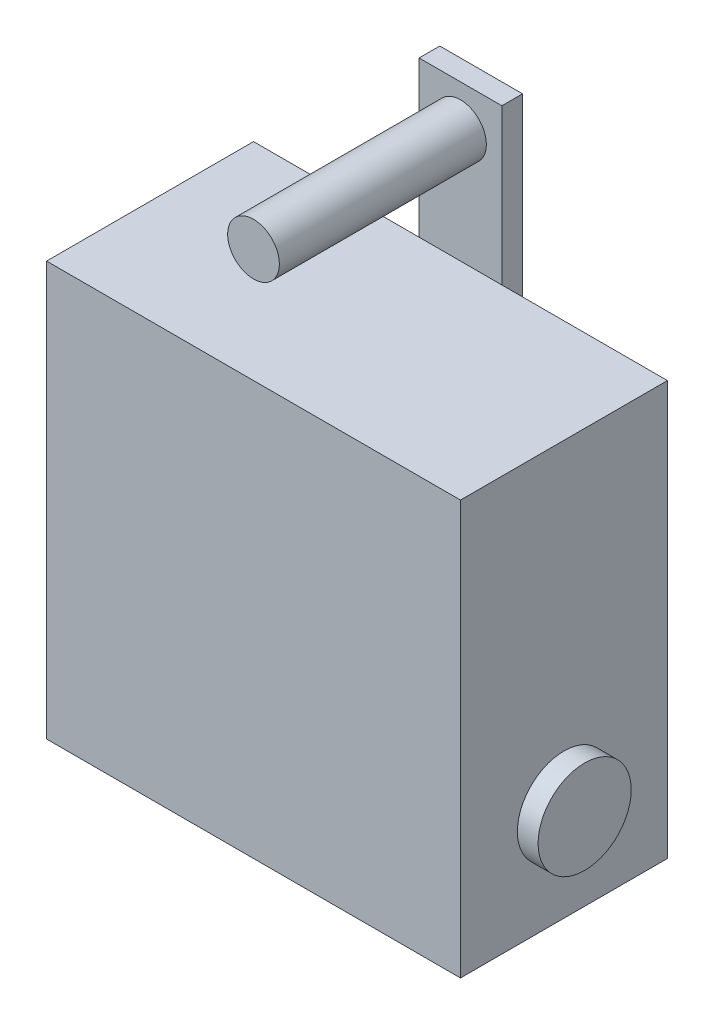
from build123d import *

# Parameters (mm, degrees)
ESQUISSE1_W        = 40
ESQUISSE1_H        = 20
BOSS_EXTRU_1_DEPTH = 40
ESQUISSE2_R        = 4.5
BOSS_EXTRU_2_DEPTH = 2
ESQUISSE3_W        = 8
ESQUISSE3_H        = 25
BOSS_EXTRU_3_DEPTH = 2
ESQUISSE4_R        = 2.5
BOSS_EXTRU_4_DEPTH = 20


with BuildPart() as part:
    # Esquisse1 → Boss.-Extru.1 (new body)
    with BuildSketch(Plane(origin=(0, 0, 0), x_dir=(1, 0, 0), z_dir=(0, 1, 0))):
        with Locations((20, 10)):
            Rectangle(ESQUISSE1_W, ESQUISSE1_H)
    extrude(amount=BOSS_EXTRU_1_DEPTH)

    # Esquisse2 → Boss.-Extru.2 (add)
    with BuildSketch(Plane(origin=(40, 0, 0), x_dir=(0, 0, -1), z_dir=(1, 0, 0))):
        with Locations(Location((10, 9.5, 0), (0, 0, 180))):
            Circle(ESQUISSE2_R)
    extrude(amount=BOSS_EXTRU_2_DEPTH)

    # Esquisse3 → Boss.-Extru.3 (add)
    with BuildSketch(Plane(origin=(0, 0, -20), x_dir=(-1, 0, 0), z_dir=(0, 0, -1))):
        with Locations((-20, 42.5)):
            Rectangle(ESQUISSE3_W, ESQUISSE3_H)
    extrude(amount=BOSS_EXTRU_3_DEPTH)

    # Esquisse4 → Boss.-Extru.4 (add)
    with BuildSketch(Plane.XY.offset(-20)):
        with Locations((20, 51)):
            Circle(ESQUISSE4_R)
    extrude(amount=BOSS_EXTRU_4_DEPTH)


solid = part.part
